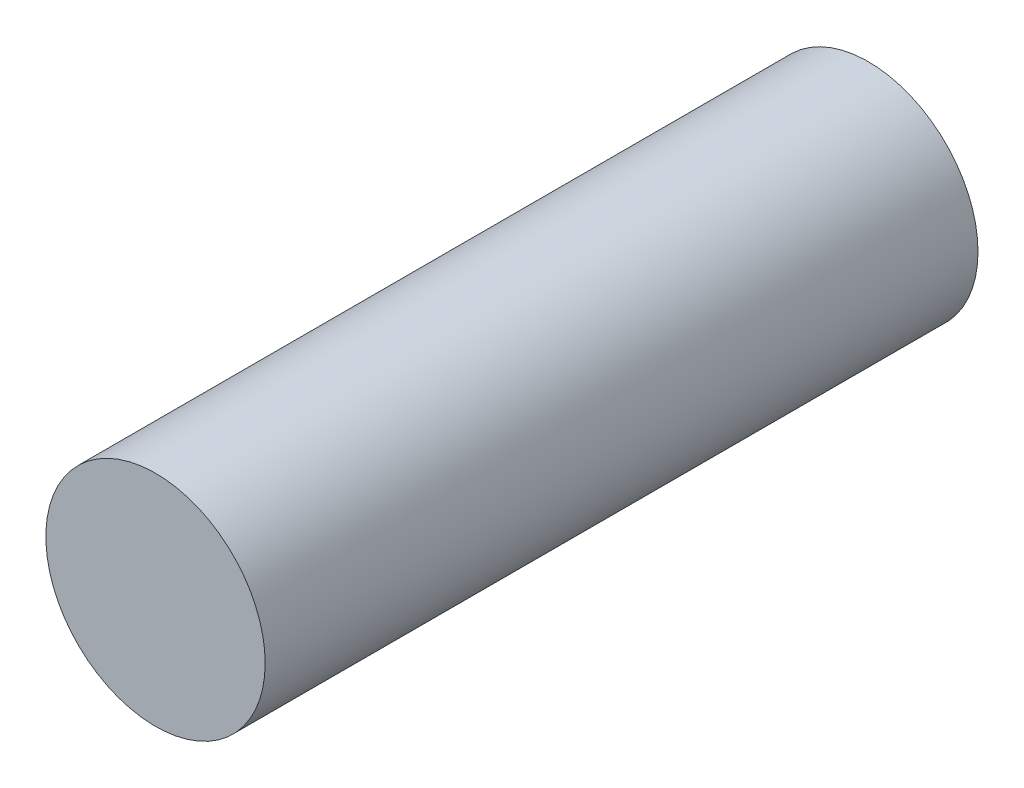
from build123d import *

# Parameters (mm, degrees)
SKETCH1_R           = 20
BOSS_EXTRUDE1_DEPTH = 130


with BuildPart() as part:
    # Sketch1 → Boss-Extrude1 (new body)
    with BuildSketch(Plane.XY):
        Circle(SKETCH1_R)
    extrude(amount=BOSS_EXTRUDE1_DEPTH)


solid = part.part
